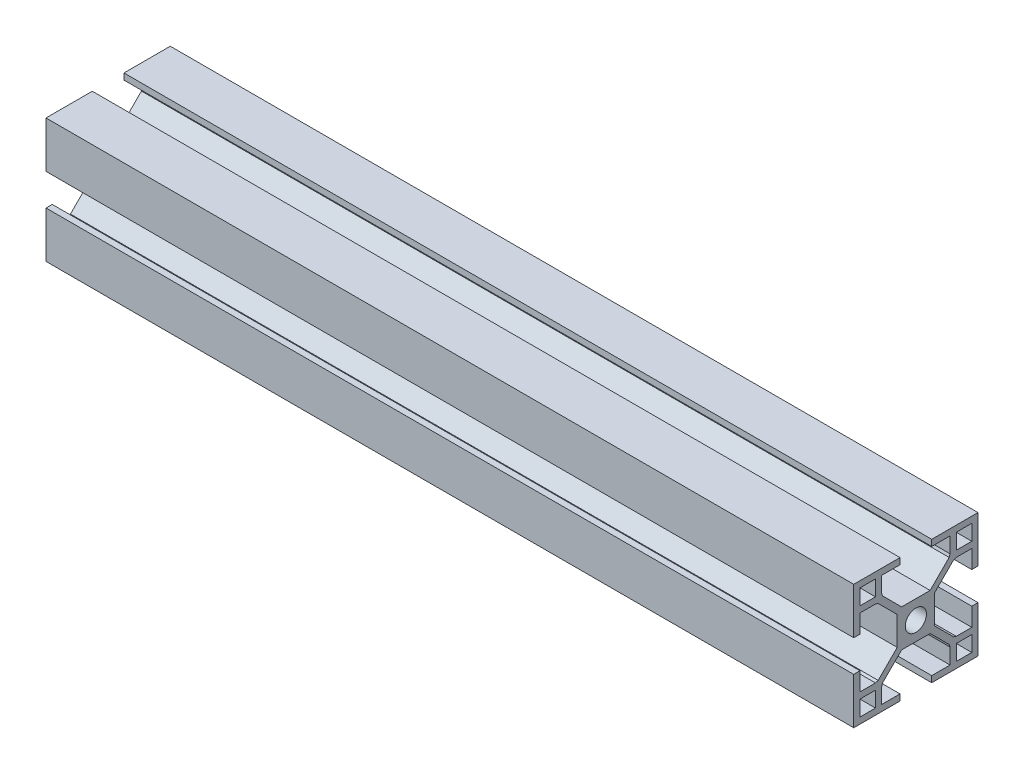
from build123d import *

# Parameters (mm, degrees)
SKETCH_1_R      = 3.4
SKETCH_1_W      = 5
SKETCH_1_H      = 5
EXTRUDE_1_DEPTH = 260


with BuildPart() as part:
    # 草图1 → 凸台-拉伸1 (new body)
    with BuildSketch(Plane(origin=(0, 0, 0), x_dir=(0, 0, -1), z_dir=(1, 0, 0))):
        Polygon((0, 6), (4.585786438, 6), (10.718811909, 12.133025471), (11, 13), (11, 18), (5.1, 18), (5.1, 20), (20, 20), (20, 5.1), (18, 5.1), (18, 11), (13, 11), (12.133025471, 10.718811909), (6, 4.585786438), (6, 0), (6, -4.585786438), (12.133025471, -10.718811909), (13, -11), (18, -11), (18, -5.1), (20, -5.1), (20, -20), (5.1, -20), (5.1, -18), (11, -18), (11, -13), (10.718811909, -12.133025471), (4.585786438, -6), (0, -6), (-4.585786438, -6), (-10.718811909, -12.133025471), (-11, -13), (-11, -18), (-5.1, -18), (-5.1, -20), (-20, -20), (-20, -5.1), (-18, -5.1), (-18, -11), (-13, -11), (-12.133025471, -10.718811909), (-6, -4.585786438), (-6, 0), (-6, 4.585786438), (-12.133025471, 10.718811909), (-13, 11), (-18, 11), (-18, 5.1), (-20, 5.1), (-20, 20), (-5.1, 20), (-5.1, 18), (-11, 18), (-11, 13), (-10.718811909, 12.133025471), (-4.585786438, 6), align=None)
        Circle(SKETCH_1_R, mode=Mode.SUBTRACT)
        with Locations((15.5, -15.5)):
            Rectangle(SKETCH_1_W, SKETCH_1_H, mode=Mode.SUBTRACT)
        with Locations((15.5, 15.5)):
            Rectangle(SKETCH_1_W, SKETCH_1_H, mode=Mode.SUBTRACT)
        with Locations((-15.5, -15.5)):
            Rectangle(SKETCH_1_W, SKETCH_1_H, mode=Mode.SUBTRACT)
        with Locations((-15.5, 15.5)):
            Rectangle(SKETCH_1_W, SKETCH_1_H, mode=Mode.SUBTRACT)
    extrude(amount=EXTRUDE_1_DEPTH)


solid = part.part
